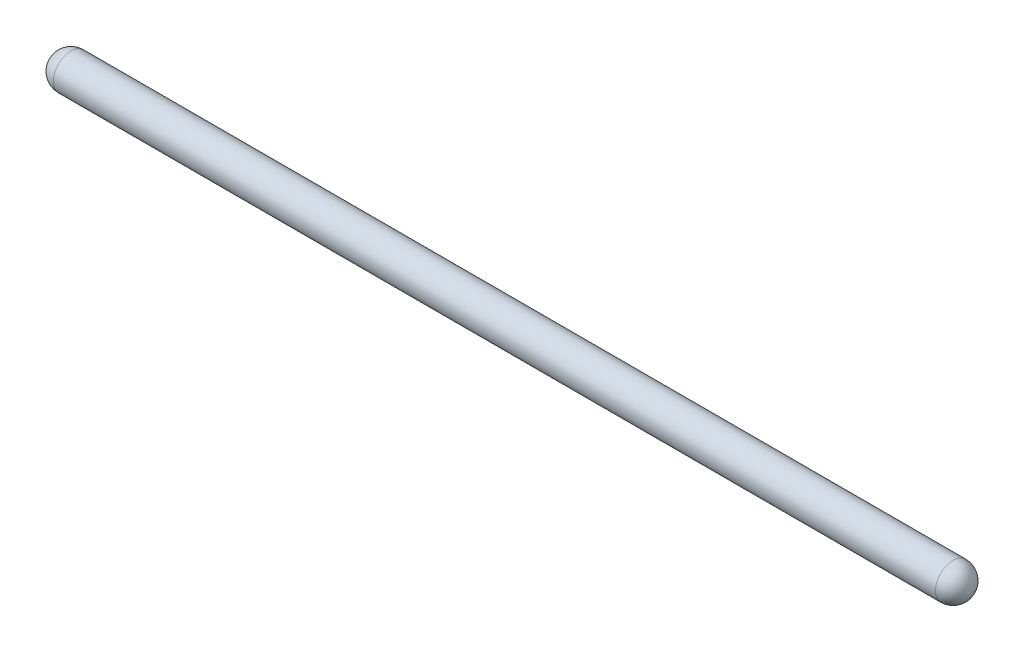
from build123d import *

# Parameters (mm, degrees)
SKETCH1_R           = 0.79375
BOSS_EXTRUDE1_DEPTH = 41.275
FILLET1_R           = 0.79375


with BuildPart() as part:
    # Sketch1 → Boss-Extrude1 (new body)
    with BuildSketch(Plane(origin=(0, 0, 0), x_dir=(0, 0, -1), z_dir=(1, 0, 0))):
        Circle(SKETCH1_R)
    extrude(amount=BOSS_EXTRUDE1_DEPTH)

    # Fillet1
    fillet1_edges = [part.edges().sort_by_distance(p)[0] for p in [
        (0, 0, 0.79375),
        (41.275, 0, 0.79375),
    ]]
    fillet(fillet1_edges, radius=FILLET1_R)


solid = part.part
